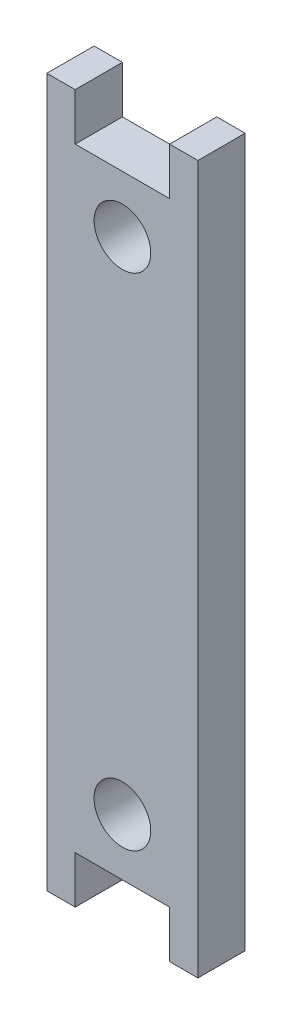
from build123d import *

# Parameters (mm, degrees)
SKETCH2_R           = 3
BOSS_EXTRUDE1_DEPTH = 5


with BuildPart() as part:
    # Sketch2 → Boss-Extrude1 (new body)
    with BuildSketch(Plane.XY):
        Polygon((-5, 37.5), (-8, 37.5), (-8, -37.5), (-5, -37.5), (-5, -32.5), (5, -32.5), (5, -37.5), (8, -37.5), (8, 37.5), (5, 37.5), (5, 32.5), (-5, 32.5), align=None)
        with Locations((0, -26.5)):
            Circle(SKETCH2_R, mode=Mode.SUBTRACT)
        with Locations((0, 26.5)):
            Circle(SKETCH2_R, mode=Mode.SUBTRACT)
    extrude(amount=BOSS_EXTRUDE1_DEPTH)


solid = part.part
